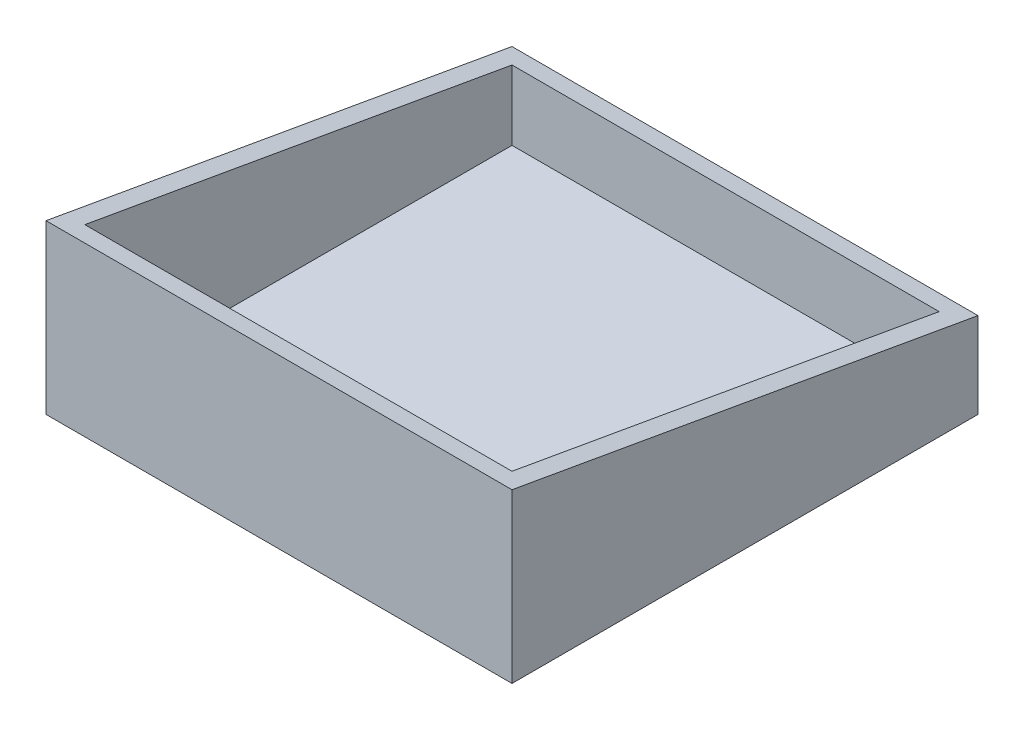
from build123d import *

# Parameters (mm, degrees)
BOSS_EXTRUDE1_DEPTH = 304.8
SHELL1_T            = -12.7


with BuildPart() as part:
    # Sketch1 → Boss-Extrude1 (new body)
    with BuildSketch(Plane(origin=(0, 0, 0), x_dir=(0, 0, -1), z_dir=(1, 0, 0))):
        Polygon((0, 0), (304.8, 0), (304.8, 56), (0, 109.74446372), align=None)
    extrude(amount=BOSS_EXTRUDE1_DEPTH)

    # Shell1
    shell1_openings = [part.faces().sort_by_distance(p)[0] for p in [
        (152.4, 82.87223186, -152.4),
    ]]
    offset(amount=SHELL1_T, openings=shell1_openings, kind=Kind.INTERSECTION)


solid = part.part
